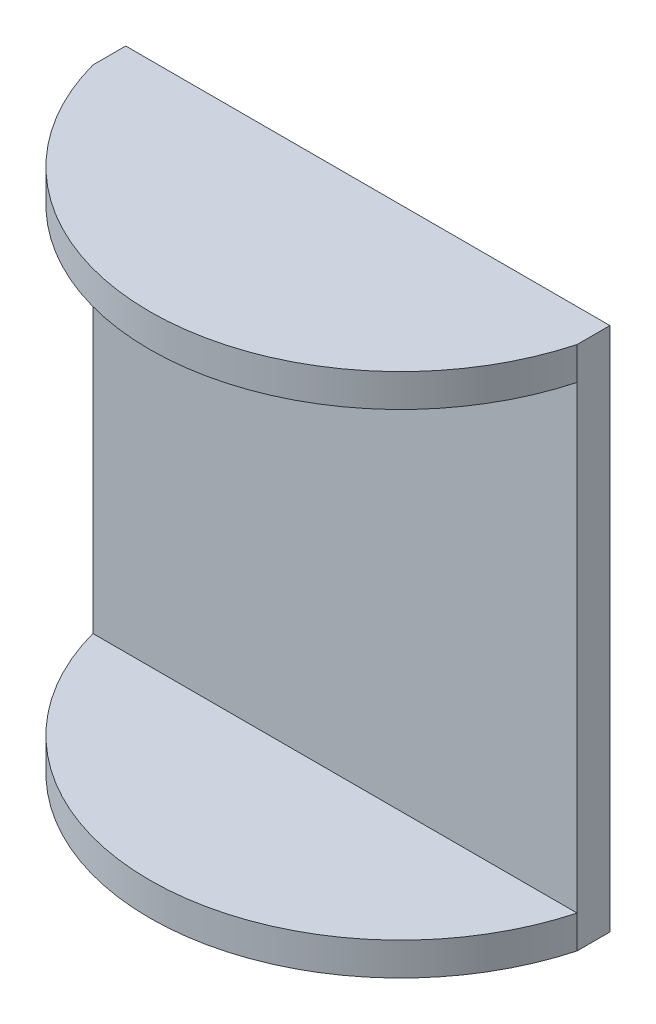
from build123d import *

# Parameters (mm, degrees)
BOSS_EXTRUDE1_DEPTH      = 5.08
BOSS_EXTRUDE2_DEPTH      = 76.2
BOSS_EXTRUDE2_DEPTH_BACK = 5.08
SKETCH3_W                = 74.93
SKETCH3_H                = 5.08
BOSS_EXTRUDE3_START      = -5.08
BOSS_EXTRUDE3_DEPTH      = 5.08


with BuildPart() as part:
    # Sketch2 → Boss-Extrude1 (new body)
    with BuildSketch(Plane(origin=(0, 0, 0), x_dir=(1, 0, 0), z_dir=(0, 1, 0))):
        with BuildLine():
            Line((-37.465, 0), (37.465, 0))
            ThreePointArc((37.465, 0), (0, -28.658189358), (-37.465, 0))
        make_face()
    extrude(amount=BOSS_EXTRUDE1_DEPTH)

    # Sketch3 → Boss-Extrude2 (add, two sides: drawn at the far end of the back side and taken through both)
    with BuildSketch(Plane(origin=(0, 5.08, 0), x_dir=(1, 0, 0), z_dir=(0, 1, 0)).offset(-BOSS_EXTRUDE2_DEPTH_BACK)):
        with Locations((0, 2.54)):
            Rectangle(SKETCH3_W, SKETCH3_H)
    extrude(amount=BOSS_EXTRUDE2_DEPTH + BOSS_EXTRUDE2_DEPTH_BACK)

    # Sketch4 → Boss-Extrude3 (add)
    with BuildSketch(Plane(origin=(0, 81.28, 0), x_dir=(1, 0, 0), z_dir=(0, 1, 0)).offset(BOSS_EXTRUDE3_START)):
        with BuildLine():
            Line((-37.465, 0), (37.465, 0))
            ThreePointArc((37.465, 0), (0, -28.658189358), (-37.465, 0))
        make_face()
    extrude(amount=BOSS_EXTRUDE3_DEPTH)


solid = part.part
